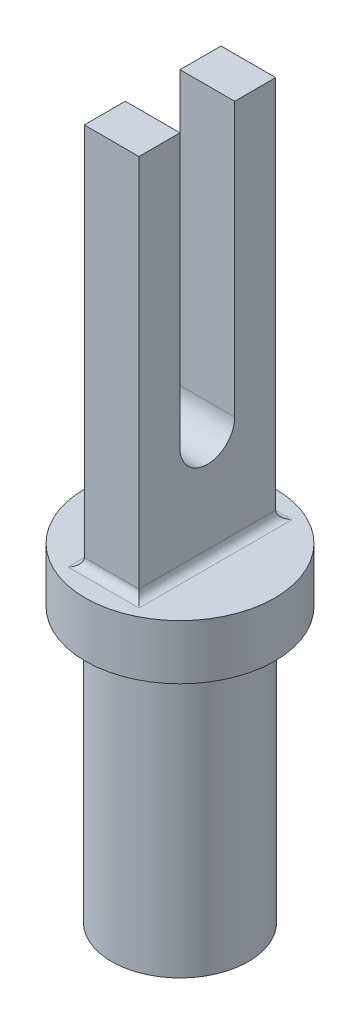
from build123d import *

# Parameters (mm, degrees)
SKETCH1_R           = 17.325
BOSS_EXTRUDE1_DEPTH = 10
SKETCH2_R           = 12.5
BOSS_EXTRUDE2_DEPTH = 50
SKETCH3_W           = 10
SKETCH3_H           = 25
BOSS_EXTRUDE3_DEPTH = 70
FILLET1_R           = 1.5
CUT_EXTRUDE1_DEPTH  = 76.488815397


with BuildPart() as part:
    # Sketch1 → Boss-Extrude1 (new body)
    with BuildSketch(Plane(origin=(0, 0, 0), x_dir=(1, 0, 0), z_dir=(0, 1, 0))):
        with Locations(Location((0, 0, 0), (0, 0, 270))):
            Circle(SKETCH1_R)
    extrude(amount=-BOSS_EXTRUDE1_DEPTH)

    # Sketch2 → Boss-Extrude2 (add)
    with BuildSketch(Plane.XZ.offset(10)):
        with Locations(Location((0, 0, 0), (0, 0, 270))):
            Circle(SKETCH2_R)
    extrude(amount=BOSS_EXTRUDE2_DEPTH)

    # Sketch3 → Boss-Extrude3 (add)
    with BuildSketch(Plane(origin=(0, 0, 0), x_dir=(1, 0, 0), z_dir=(0, 1, 0))):
        Rectangle(SKETCH3_W, SKETCH3_H)
    extrude(amount=BOSS_EXTRUDE3_DEPTH)

    # Fillet1
    fillet1_edges = [part.edges().sort_by_distance(p)[0] for p in [
        (5, 0, 0),
        (0, 0, -12.5),
        (-5, 0, 0),
        (0, 0, 12.5),
    ]]
    fillet(fillet1_edges, radius=FILLET1_R)

    # Sketch4 → Cut-Extrude1 (cut, through all)
    with BuildSketch(Plane.ZY.offset(5)):
        with BuildLine():
            Line((5, 70), (-5, 70))
            Line((-5, 70), (-5, 20))
            ThreePointArc((-5, 20), (0, 15), (5, 20))
            Line((5, 20), (5, 70))
        make_face()
    extrude(amount=-CUT_EXTRUDE1_DEPTH, mode=Mode.SUBTRACT)


solid = part.part
